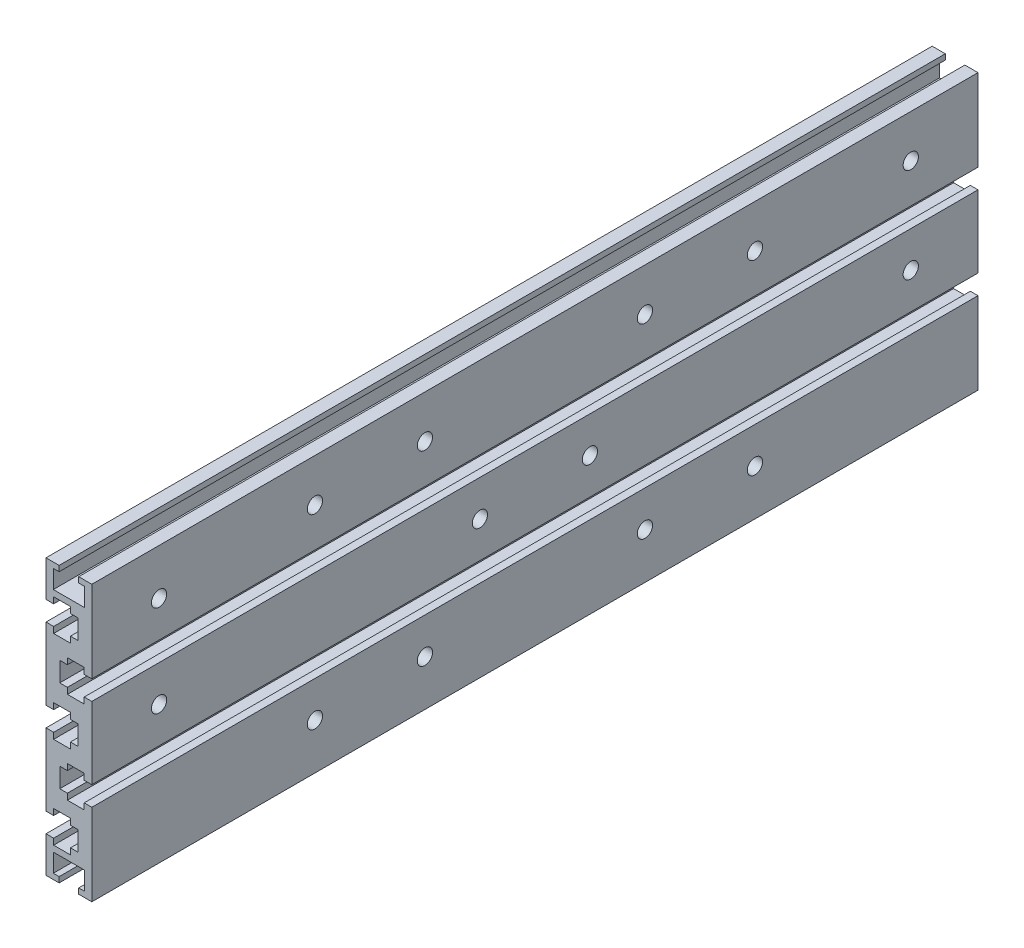
from build123d import *

# Parameters (mm, degrees)
EXTRUDE_1_DEPTH           = 290
HOLE_WIZARD_5_0_5_1_D     = 5
HOLE_WIZARD_5_0_5_2_D     = 5
HOLE_WIZARD_5_0_5_2_DEPTH = 20
HOLE_WIZARD_5_0_5_2_TIP   = 1.502151548


with BuildPart() as part:
    # Sketch1 → 凸台-拉伸1 (new body)
    with BuildSketch(Plane.XY):
        Polygon((-6.5, 45), (-3.2, 45), (-3.2, 43.2), (-5.1, 43.2), (-5.1, 37.2), (5.1, 37.2), (5.1, 43.2), (3.2, 43.2), (3.2, 45), (6.5, 45), (7.5, 45), (7.5, 44), (7.5, 18.2), (5, 18.2), (5, 20.2), (-0.5, 20.2), (-0.5, 18.2), (-3, 18.2), (-3, 11.8), (-0.5, 11.8), (-0.5, 9.8), (5, 9.8), (5, 11.8), (7.5, 11.8), (7.5, -11.8), (5, -11.8), (5, -9.8), (-0.5, -9.8), (-0.5, -11.8), (-3, -11.8), (-3, -18.2), (-0.5, -18.2), (-0.5, -20.2), (5, -20.2), (5, -18.2), (7.5, -18.2), (7.5, -44), (7.5, -45), (6.5, -45), (3.2, -45), (3.2, -43.2), (5.1, -43.2), (5.1, -37.2), (-5.1, -37.2), (-5.1, -43.2), (-3.2, -43.2), (-3.2, -45), (-6.496721962, -45), (-7.5, -45), (-7.5, -44), (-7.5, -33.2), (-5, -33.2), (-5, -35.2), (0.5, -35.2), (0.5, -33.2), (3, -33.2), (3, -26.8), (0.5, -26.8), (0.5, -24.8), (-5, -24.8), (-5, -26.8), (-7.5, -26.8), (-7.5, -3.2), (-5, -3.2), (-5, -5.2), (0.5, -5.2), (0.5, -3.2), (3, -3.2), (3, 3.2), (0.5, 3.2), (0.5, 5.2), (-5, 5.2), (-5, 3.2), (-7.5, 3.2), (-7.5, 26.8), (-5, 26.8), (-5, 24.8), (0.5, 24.8), (0.5, 26.8), (3, 26.8), (3, 33.2), (0.5, 33.2), (0.5, 35.2), (-5, 35.2), (-5, 33.2), (-7.5, 33.2), (-7.5, 44), (-7.5, 45), align=None)
    extrude(amount=EXTRUDE_1_DEPTH)

    # Ø5.0 (5) 直径孔1 (through all)
    with Locations(Plane(origin=(7.5, 0, 0), x_dir=(0, 0, -1), z_dir=(1, 0, 0))):
        with Locations((-268, 30)):
            Hole(HOLE_WIZARD_5_0_5_1_D / 2)

    # Ø5.0 (5) 直径孔2
    with Locations(Plane(origin=(7.5, 0, 0), x_dir=(0, 0, -1), z_dir=(1, 0, 0))):
        with Locations((-217, 30.986103622), (-181, 30.986103622), (-109, 30.986103622), (-73, 30.986103622), (-22, 30.986103622), (-268, 0), (-217, -30), (-181, -30), (-163, 0), (-127, 0), (-109, -30), (-73, -30), (-22, 0)):
            Hole(HOLE_WIZARD_5_0_5_2_D / 2, depth=HOLE_WIZARD_5_0_5_2_DEPTH)
            with Locations((0, 0, -(HOLE_WIZARD_5_0_5_2_DEPTH + HOLE_WIZARD_5_0_5_2_TIP / 2))):  # 118° drill point
                Cone(0, HOLE_WIZARD_5_0_5_2_D / 2, HOLE_WIZARD_5_0_5_2_TIP, mode=Mode.SUBTRACT)


solid = part.part
